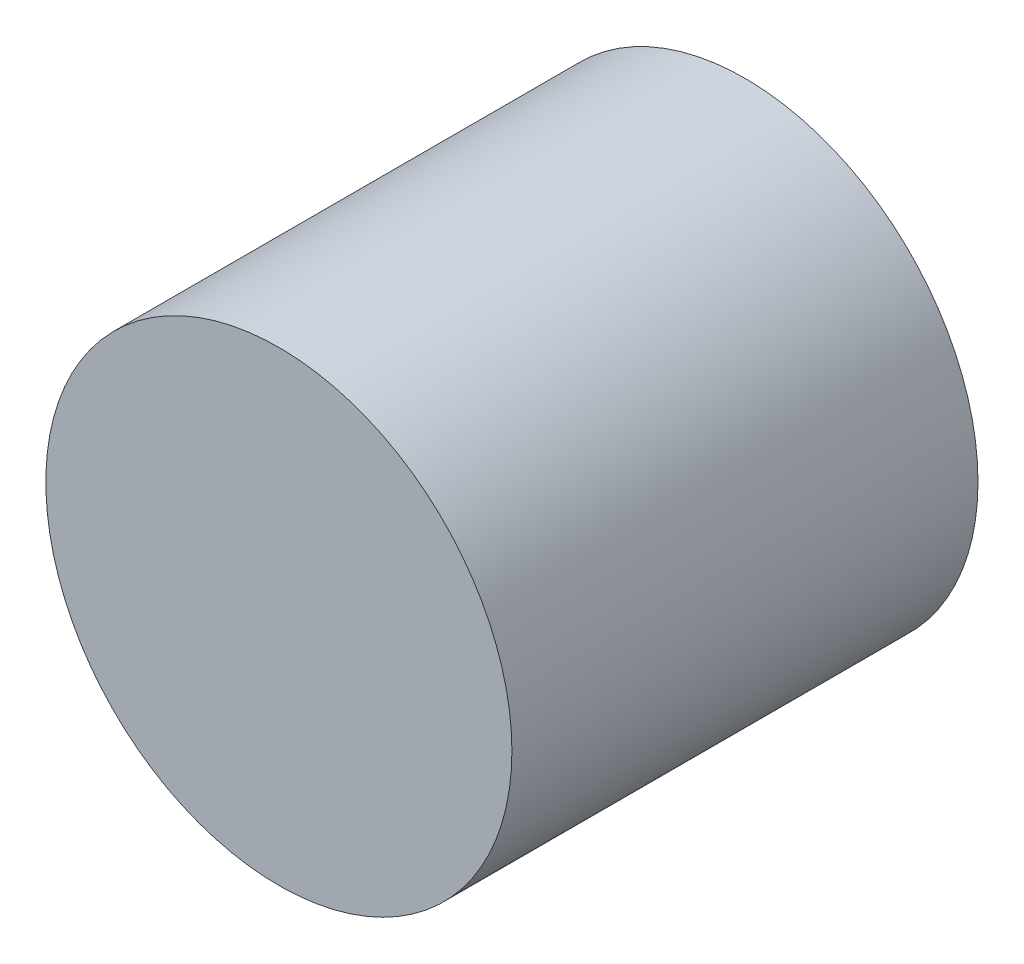
from build123d import *

# Parameters (mm, degrees)
SKETCH_1_R      = 6
EXTRUDE_1_DEPTH = 6


with BuildPart() as part:
    # 草图1 → 凸台-拉伸1 (new, symmetric)
    with BuildSketch(Plane.XY):
        Circle(SKETCH_1_R)
    extrude(amount=EXTRUDE_1_DEPTH, both=True)


solid = part.part
